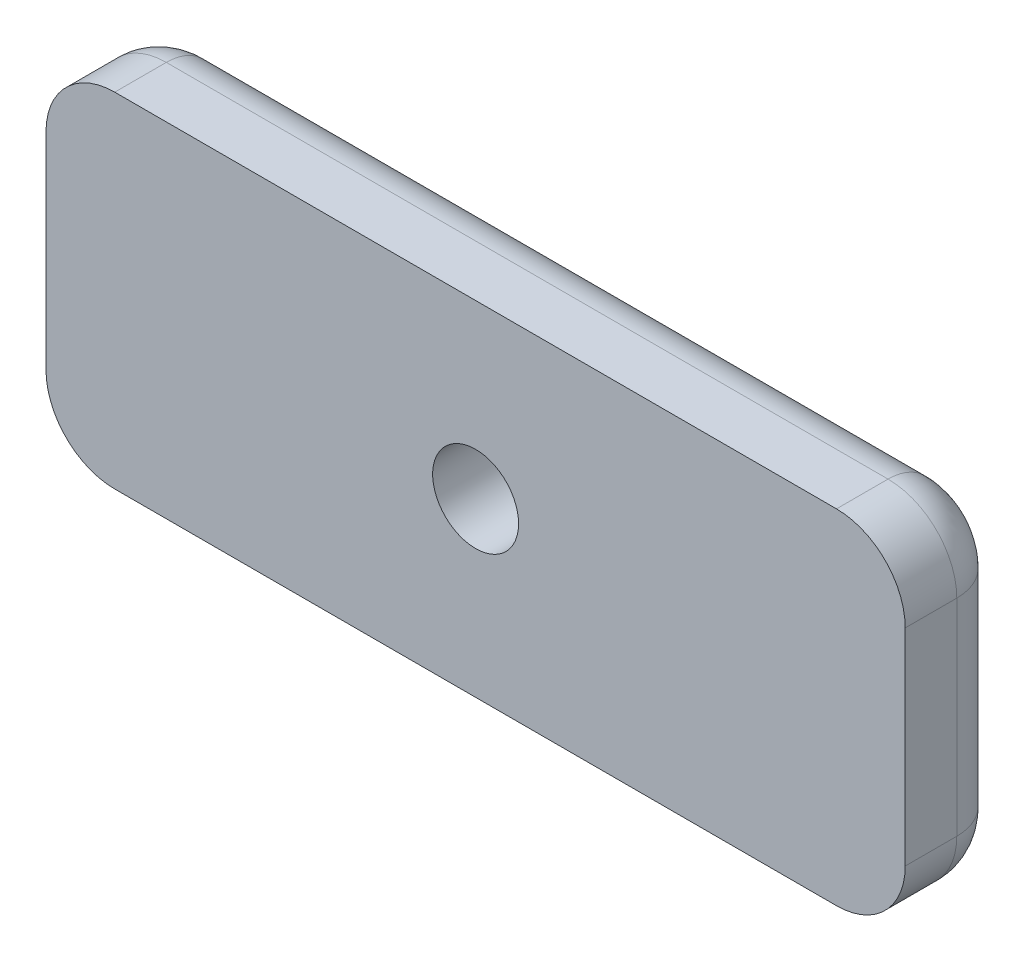
from build123d import *

# Parameters (mm, degrees)
SKETCH1_R           = 2.5
BOSS_EXTRUDE1_DEPTH = 6
FILLET1_R           = 3


with BuildPart() as part:
    # Sketch1 → Boss-Extrude1 (new body)
    with BuildSketch(Plane.XY):
        with BuildLine():
            Line((-21, 11.584180911), (21, 11.584180911))
            ThreePointArc((21, 11.584180911), (23.828427125, 10.412608036), (25, 7.584180911))
            Line((25, 7.584180911), (25, -4.415819089))
            ThreePointArc((25, -4.415819089), (23.828427125, -7.244246214), (21, -8.415819089))
            Line((21, -8.415819089), (-21, -8.415819089))
            ThreePointArc((-21, -8.415819089), (-23.828427125, -7.244246214), (-25, -4.415819089))
            Line((-25, -4.415819089), (-25, 7.584180911))
            ThreePointArc((-25, 7.584180911), (-23.828427125, 10.412608036), (-21, 11.584180911))
        make_face()
        with Locations((0, 1.584180911)):
            Circle(SKETCH1_R, mode=Mode.SUBTRACT)
    extrude(amount=BOSS_EXTRUDE1_DEPTH)

    # Fillet1
    fillet1_edges = [part.edges().sort_by_distance(p)[0] for p in [
        (-25, 1.584180911, 0),
        (-23.828427125, 10.412608036, 0),
        (0, 11.584180911, 0),
        (23.828427125, 10.412608036, 0),
        (25, 1.584180911, 0),
        (23.828427125, -7.244246214, 0),
        (0, -8.415819089, 0),
        (-23.828427125, -7.244246214, 0),
    ]]
    fillet(fillet1_edges, radius=FILLET1_R)


solid = part.part
